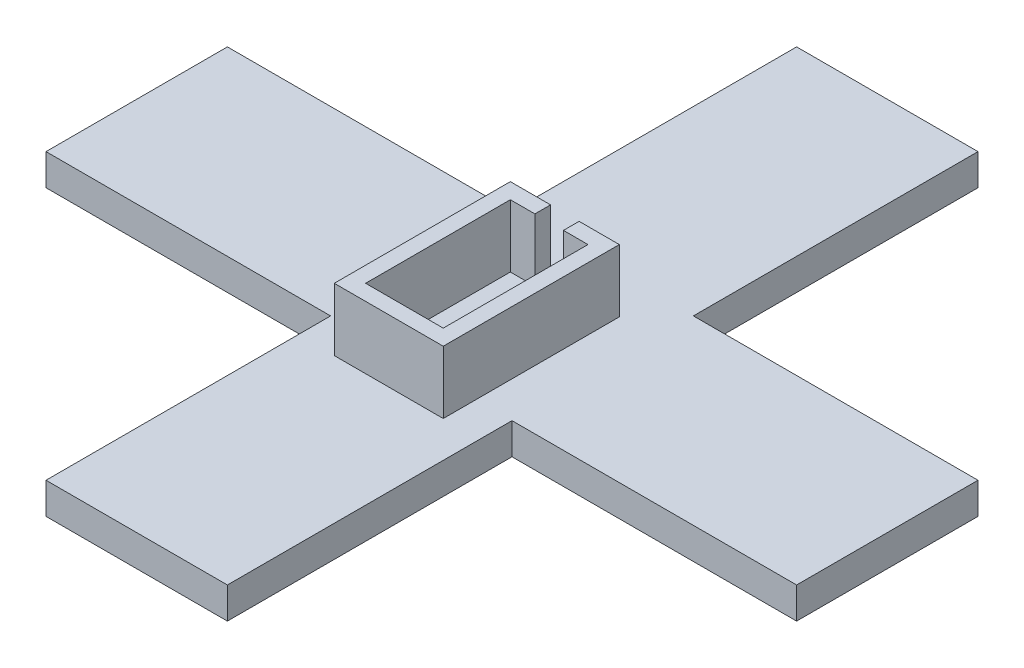
from build123d import *

# Parameters (mm, degrees)
BOSS_EXTRUDE18_DEPTH = 5
BOSS_EXTRUDE19_DEPTH = 10


with BuildPart() as part:
    # Sketch21 → Boss-Extrude18 (new body)
    with BuildSketch(Plane(origin=(0, 0, 0), x_dir=(1, 0, 0), z_dir=(0, 1, 0))):
        Polygon((0, 59.92), (-14.48, 59.92), (-14.48, 14.48), (-59.92, 14.48), (-59.92, 0), (-59.92, -14.48), (-14.48, -14.48), (-14.48, -59.92), (0, -59.92), (14.48, -59.92), (14.48, -14.48), (59.92, -14.48), (59.92, 0), (59.92, 14.48), (14.48, 14.48), (14.48, 59.92), align=None)
    extrude(amount=BOSS_EXTRUDE18_DEPTH)

    # Sketch23 → Boss-Extrude19 (add)
    with BuildSketch(Plane(origin=(0, 5, 0), x_dir=(1, 0, 0), z_dir=(0, 1, 0))):
        Polygon((-8.7, 8.435), (-2.28, 8.435), (-2.28, 5.935), (-6.2, 5.935), (-6.2, -17.175), (6.2, -17.175), (6.2, 5.935), (2.28, 5.935), (2.28, 8.435), (8.7, 8.435), (8.7, -19.675), (-8.7, -19.675), align=None)
    extrude(amount=BOSS_EXTRUDE19_DEPTH)


solid = part.part
